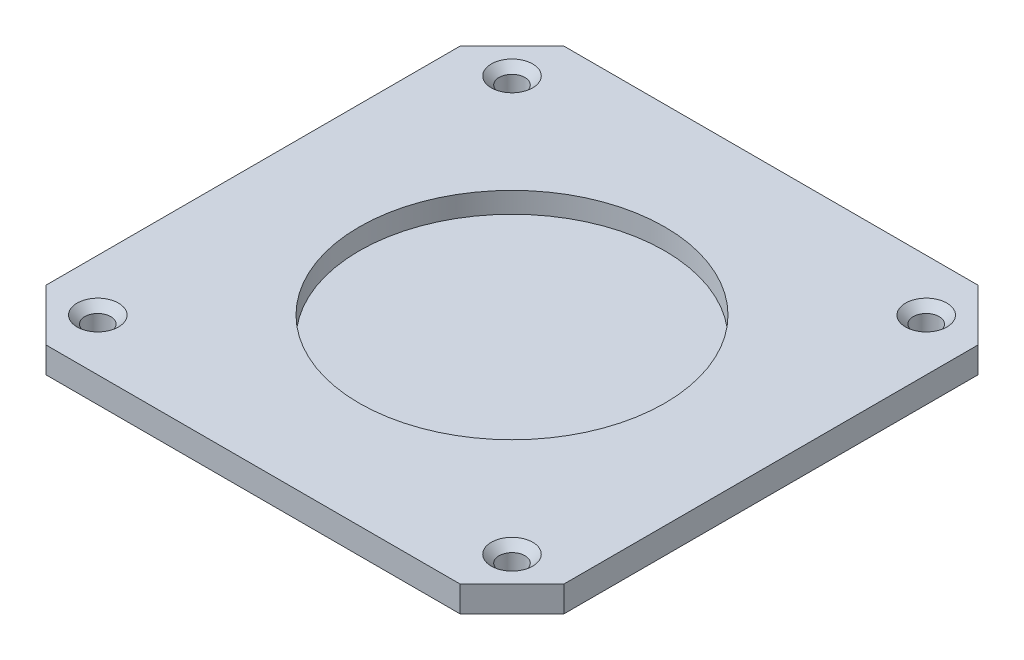
from build123d import *

# Parameters (mm, degrees)
SKETCH1_W                                       = 100
SKETCH1_H                                       = 100
BOSS_EXTRUDE1_DEPTH                             = 2.5
CSK_FOR_M5_FLAT_HEAD_MACHINE_SCREW1_D           = 5
CSK_FOR_M5_FLAT_HEAD_MACHINE_SCREW1_CSINK_D     = 8
CSK_FOR_M5_FLAT_HEAD_MACHINE_SCREW1_CSINK_ANGLE = 90
CHAMFER1_SIZE                                   = 10
F_1_0MM_CLEARANCE_DOWEL_HOLE1_D                 = 59
F_1_0MM_CLEARANCE_DOWEL_HOLE1_DEPTH             = 4
CIRPATTERN3_COUNT                               = 4


with BuildPart() as part:
    # Sketch1 → Boss-Extrude1 (new, symmetric)
    with BuildSketch(Plane(origin=(0, 0, 0), x_dir=(1, 0, 0), z_dir=(0, 1, 0))):
        Rectangle(SKETCH1_W, SKETCH1_H)
    extrude(amount=BOSS_EXTRUDE1_DEPTH, both=True)

    # CSK for M5 Flat Head Machine Screw1 (through all)
    with Locations(Plane(origin=(0, 2.5, 0), x_dir=(1, 0, 0), z_dir=(0, 1, 0))):
        with Locations((-40, 40)):
            csk_for_m5_flat_head_machine_screw1 = CounterSinkHole(CSK_FOR_M5_FLAT_HEAD_MACHINE_SCREW1_D / 2, CSK_FOR_M5_FLAT_HEAD_MACHINE_SCREW1_CSINK_D / 2, counter_sink_angle=CSK_FOR_M5_FLAT_HEAD_MACHINE_SCREW1_CSINK_ANGLE)

    # Chamfer1
    chamfer1_edges = [part.edges().sort_by_distance(p)[0] for p in [
        (50, 0, 50),
        (-50, 0, 50),
        (-50, 0, -50),
        (50, 0, -50),
    ]]
    chamfer(chamfer1_edges, length=CHAMFER1_SIZE)

    # Ø1.0mm Clearance Dowel Hole1
    with Locations(Plane(origin=(0, 2.5, 0), x_dir=(1, 0, 0), z_dir=(0, 1, 0))):
        with Locations((0, 0)):
            Hole(F_1_0MM_CLEARANCE_DOWEL_HOLE1_D / 2, depth=F_1_0MM_CLEARANCE_DOWEL_HOLE1_DEPTH)

    # CirPattern3: CSK for M5 Flat Head Machine Screw1 ×4 about axis
    cirpattern3_axis = Axis((0, 0, 0), (0, 1, 0))
    for i in range(1, CIRPATTERN3_COUNT):
        add(csk_for_m5_flat_head_machine_screw1.rotate(cirpattern3_axis, i * 360 / CIRPATTERN3_COUNT), mode=Mode.SUBTRACT)


solid = part.part
